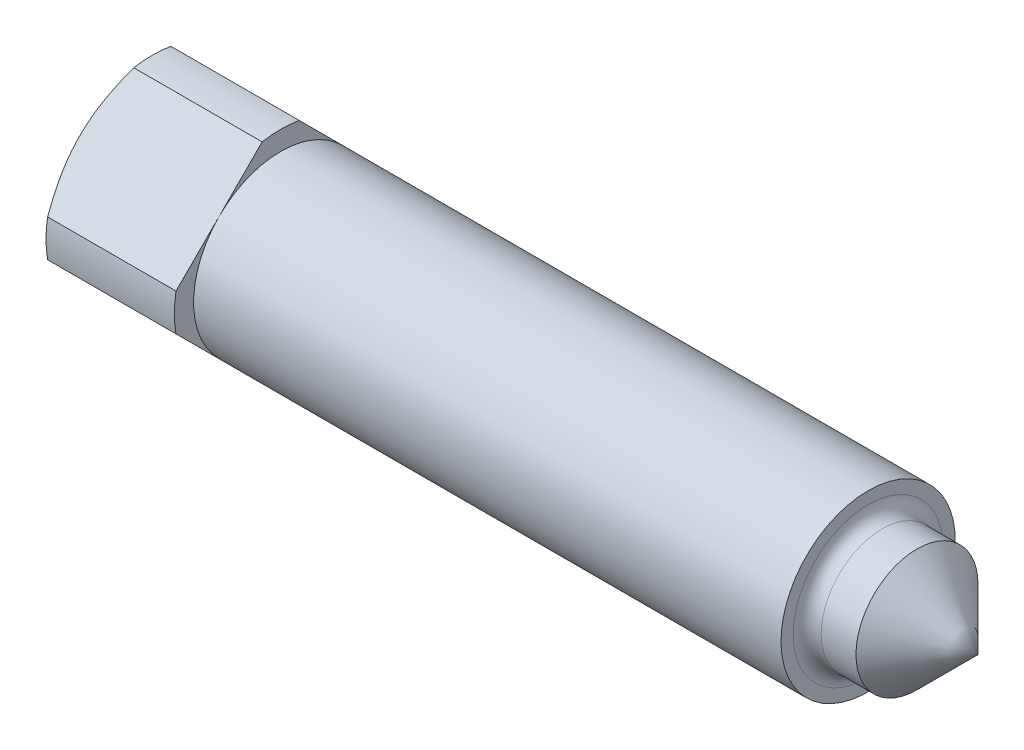
from build123d import *

# Parameters (mm, degrees)
SKETCH1_R          = 6.1
BASEHEAD_DEPTH     = 8
SKETCH2_OUTSIDE_W  = 18.004
SKETCH2_OUTSIDE_H  = 18.004
CUT_EXTRUDE1_DEPTH = 8
FILLET1_R          = 0.8


with BuildPart() as part:
    # Sketch1 → BaseHead (new body)
    with BuildSketch(Plane(origin=(0, 0, 0), x_dir=(0, 0, -1), z_dir=(1, 0, 0))):
        Circle(SKETCH1_R)
    extrude(amount=BASEHEAD_DEPTH)

    # Sketch2 outside → Cut-Extrude1 (cut)
    with BuildSketch(Plane(origin=(0, 2.662946325, -1.492108674), x_dir=(0, 0, 1), z_dir=(-1, 0, 0))):
        with Locations((1.492, -2.663)):
            Rectangle(SKETCH2_OUTSIDE_W, SKETCH2_OUTSIDE_H)
        Polygon((8.563176486, -2.662946325), (1.492108674, 4.408121487), (-5.578959138, -2.662946325), (1.492108674, -9.734014137), align=None, mode=Mode.SUBTRACT)
    extrude(amount=-CUT_EXTRUDE1_DEPTH, mode=Mode.SUBTRACT)

    # Sketch3 → Cut-Revolve1 (revolve, cut)
    with BuildSketch(Plane(origin=(1.259716749, -5.274716749, 0), x_dir=(0, -1, 0), z_dir=(0, 0, 1))):
        Polygon((-11.984716749, -1.259716749), (-10.274716749, -1.259716749), (-11.984716749, -0.272447788), align=None)
    revolve(axis=Axis((1.545283251, 0, 0), (-1, 0, 0)), mode=Mode.SUBTRACT)

    # Sketch4 → BaseBody (revolve)
    with BuildSketch(Plane(origin=(-10.34721472, 12.84721472, 0), x_dir=(0, -1, 0), z_dir=(0, 0, 1)), mode=Mode.PRIVATE) as basebody_sk:
        Polygon((12.84721472, 18.34721472), (17.84721472, 18.34721472), (17.84721472, 52.04721472), (16.34721472, 52.04721472), (16.34721472, 54.84721472), (12.84721472, 58.34721472), align=None)
    revolve(basebody_sk.sketch.rotate(Axis((14.086803097, 0, 0), (-1, 0, 0)), 180), axis=Axis((14.086803097, 0, 0), (-1, 0, 0)))

    # Fillet1
    fillet1_edges = [part.edges().sort_by_distance(p)[0] for p in [
        (41.7, -3.5, 0),
    ]]
    fillet(fillet1_edges, radius=FILLET1_R)


solid = part.part
